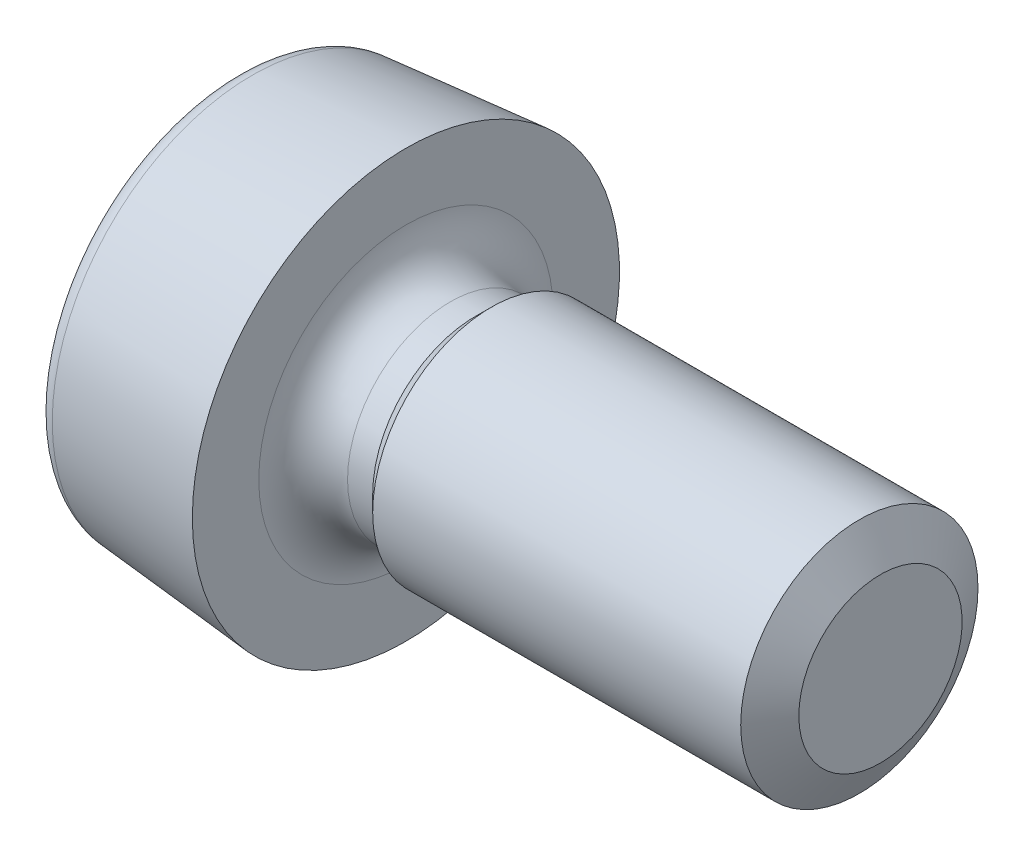
from build123d import *

# Parameters (mm, degrees)
PATTERN_CIRCULAR_1_COUNT = 2
PATTERN_CIRCULAR_1_ANGLE = 90


with BuildPart() as part:
    # 草图3 → Revolve 850 (revolve)
    with BuildSketch(Plane.XY, mode=Mode.PRIVATE) as revolve_850_sk:
        with BuildLine():
            Line((0, 0), (6.8, 0))
            Line((6.8, 0), (6.8, 1.25))
            Line((6.8, 1.25), (2.7, 1.25))
            Line((2.7, 1.25), (2.5325, 1.0825))
            Line((2.5325, 1.0825), (2.2675, 1.0825))
            ThreePointArc((2.2675, 1.0825), (1.93692758, 1.21942758), (1.8, 1.55))
            Line((1.8, 1.55), (1.8, 2.25))
            Line((1.8, 2.25), (0.182568851, 2.10849311))
            ThreePointArc((0.182568851, 2.10849311), (0.052544533, 2.044372212), (0, 1.909254171))
            Line((0, 1.909254171), (0, 0))
        make_face()
    revolve(revolve_850_sk.sketch.rotate(Axis((-2.16958059, 0, 0), (1, 0, 0)), 90), axis=Axis((-2.16958059, 0, 0), (1, 0, 0)))

    # 草图4 → 切除-旋转1 (revolve, cut)
    with BuildSketch(Plane.XY, mode=Mode.PRIVATE) as cut_revolve_1_sk:
        Polygon((6.577437203, 1.25), (7.027437203, 1.25), (6.8, 0.8603), align=None)
    revolve(cut_revolve_1_sk.sketch.rotate(Axis((-0.21798541, 0, 0), (1, 0, 0)), 90), axis=Axis((-0.21798541, 0, 0), (1, 0, 0)), mode=Mode.SUBTRACT)

    # 草图5 → 切除-放样1 section 0
    with BuildSketch(Plane.ZY, mode=Mode.PRIVATE) as loft_1_s0:
        with BuildLine():
            Line((-0.225, 1.35), (0.225, 1.35))
            Line((0.225, 1.35), (0.225, -1.35))
            Line((0.225, -1.35), (-0.225, -1.35))
            Line((-0.225, -1.35), (-0.225, 1.35))
        make_face()
    loft_1 = loft([loft_1_s0.sketch, Vertex(1.2, 0, 0)], mode=Mode.SUBTRACT)

    # 阵列(圆周)1: 切除-放样1 ×2 about axis
    pattern_circular_1_axis = Axis((0, 0, 0), (1, 0, 0))
    for i in range(1, PATTERN_CIRCULAR_1_COUNT):
        add(loft_1.rotate(pattern_circular_1_axis, i * PATTERN_CIRCULAR_1_ANGLE / (PATTERN_CIRCULAR_1_COUNT - 1)), mode=Mode.SUBTRACT)


solid = part.part
